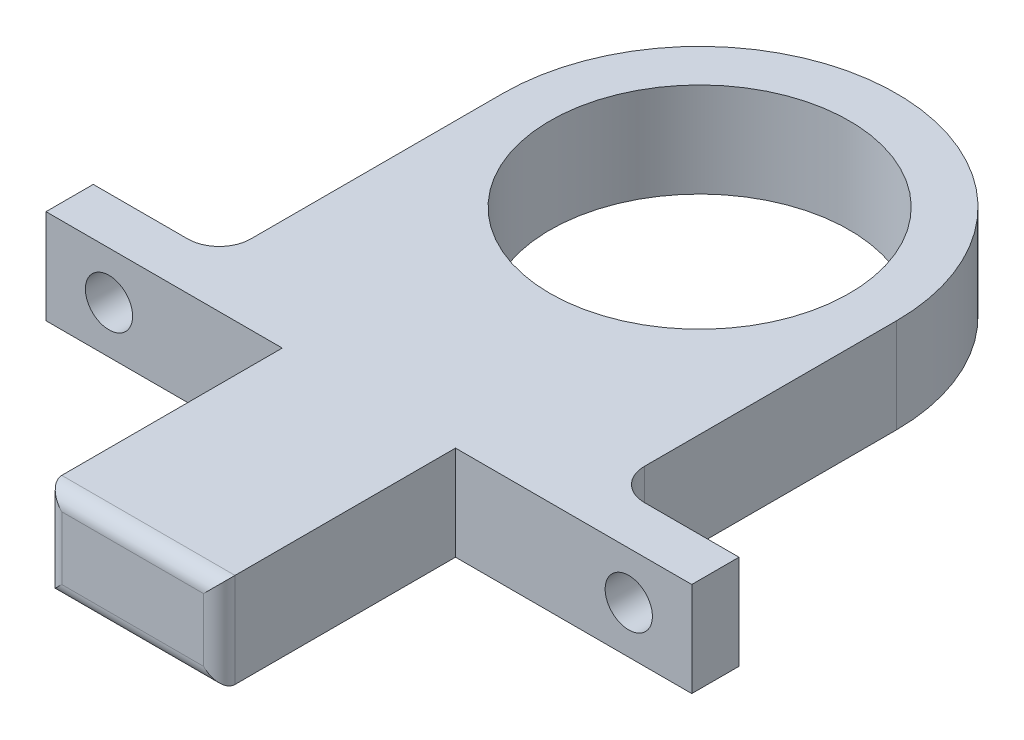
from build123d import *

# Parameters (mm, degrees)
CROQUIS1_R              = 9.5
SALIENTE_EXTRUIR1_DEPTH = 6
CROQUIS2_R              = 1.5
CORTAR_EXTRUIR1_DEPTH   = 6
CROQUIS3_R              = 3
CORTAR_EXTRUIR2_DEPTH   = 6
REDONDEO1_R             = 1


with BuildPart() as part:
    # Croquis1 → Saliente-Extruir1 (new body)
    with BuildSketch(Plane(origin=(0, 0, 0), x_dir=(1, 0, 0), z_dir=(0, 1, 0))):
        with BuildLine():
            ThreePointArc((12.5, 0), (0, 12.5), (-12.5, 0))
            Line((-12.5, 0), (-12.5, -16))
            ThreePointArc((-12.5, -16), (-13.085786438, -17.414213562), (-14.5, -18))
            Line((-14.5, -18), (-20.5, -18))
            Line((-20.5, -18), (-20.5, -21))
            Line((-20.5, -21), (-5.5, -21))
            Line((-5.5, -21), (-5.5, -36))
            Line((-5.5, -36), (5.5, -36))
            Line((5.5, -36), (5.5, -21))
            Line((5.5, -21), (20.5, -21))
            Line((20.5, -21), (20.5, -18))
            Line((20.5, -18), (14.5, -18))
            ThreePointArc((14.5, -18), (13.085786438, -17.414213562), (12.5, -16))
            Line((12.5, -16), (12.5, 0))
        make_face()
        with Locations(Location((0, 0, 0), (0, 0, 270))):
            Circle(CROQUIS1_R, mode=Mode.SUBTRACT)
    extrude(amount=SALIENTE_EXTRUIR1_DEPTH)

    # Croquis2 → Cortar-Extruir1 (cut)
    with BuildSketch(Plane.XY.offset(21)):
        with Locations((-16.5, 3)):
            Circle(CROQUIS2_R)
        with Locations((16.5, 3)):
            Circle(CROQUIS2_R)
    extrude(amount=-CORTAR_EXTRUIR1_DEPTH, mode=Mode.SUBTRACT)

    # Croquis3 → Cortar-Extruir2 (cut)
    with BuildSketch(Plane(origin=(0, 0, 18), x_dir=(-1, 0, 0), z_dir=(0, 0, -1))):
        with Locations((-16.5, 3)):
            Circle(CROQUIS3_R)
        with Locations((16.5, 3)):
            Circle(CROQUIS3_R)
    extrude(amount=CORTAR_EXTRUIR2_DEPTH, mode=Mode.SUBTRACT)

    # Redondeo1
    redondeo1_edges = [part.edges().sort_by_distance(p)[0] for p in [
        (5.5, 3, 36),
        (-5.5, 3, 36),
        (0, 6, 36),
        (0, 0, 36),
    ]]
    fillet(redondeo1_edges, radius=REDONDEO1_R)


solid = part.part
